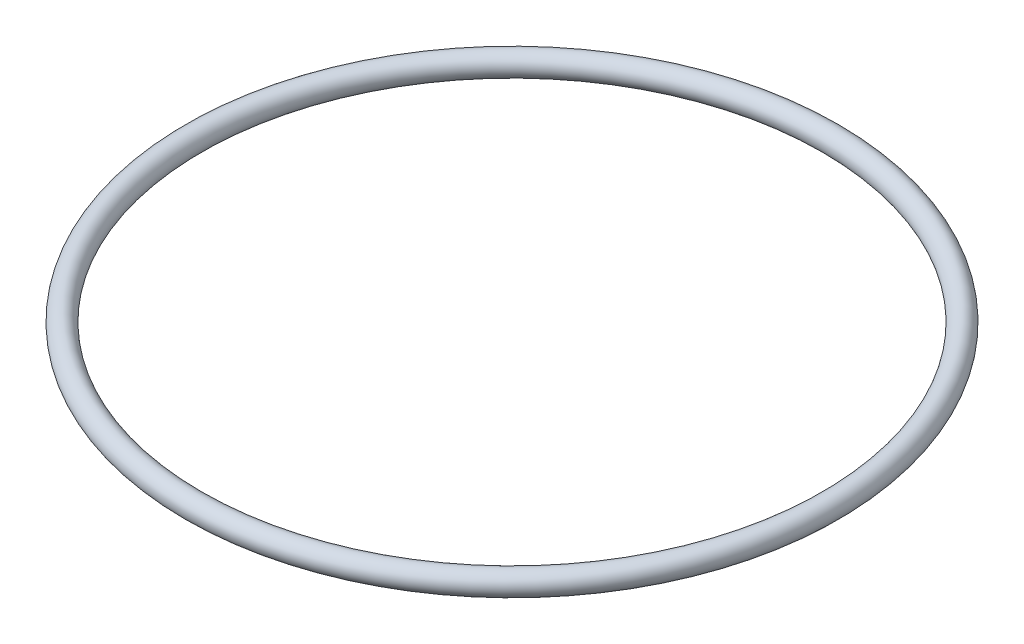
from build123d import *

# Parameters (mm, degrees)
SWEEP1_PROFILE_R = 1.2


with BuildPart() as part:
    # Sweep1: sweep along a path in Sketch1
    with BuildLine(Plane(origin=(0, 0, 0), x_dir=(1, 0, 0), z_dir=(0, 1, 0))) as sweep1_path:
        CenterArc((0, 0), 33.8, 0, 360)
    # Sweep1 profile (on start of the path) → Sweep1 (sweep)
    with BuildSketch(Plane(origin=(33.8, 0, 0), x_dir=(-1, 0, 0), z_dir=(0, 0, -1))):
        Circle(SWEEP1_PROFILE_R)
    sweep(path=sweep1_path.line)


solid = part.part
